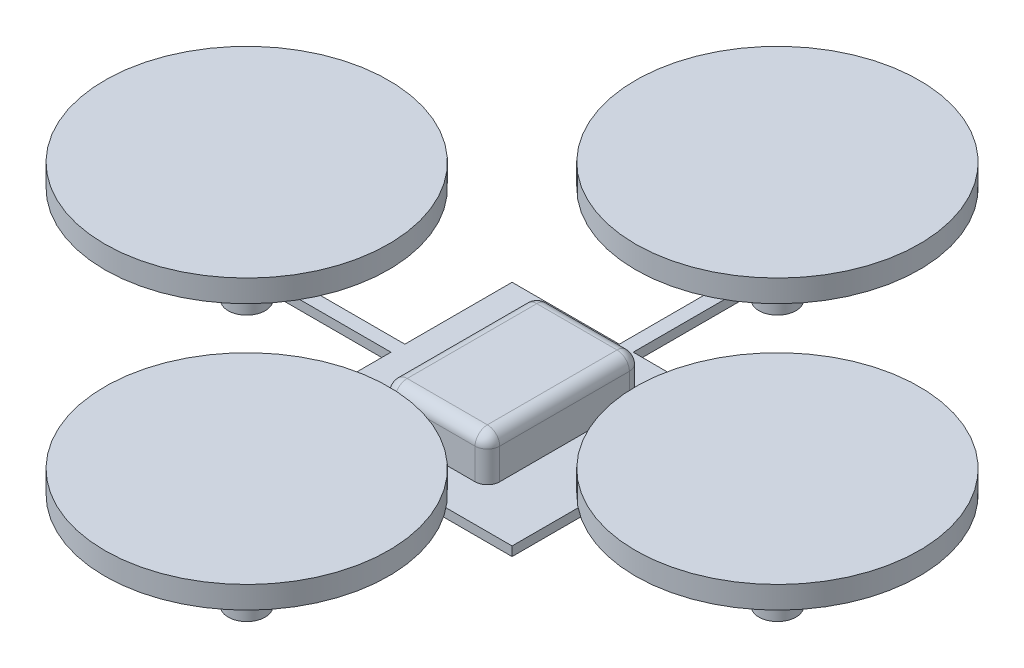
from build123d import *

# Parameters (mm, degrees)
BOSS_EXTRUDE1_DEPTH        = 1.5
BOSS_EXTRUDE2_DEPTH        = 11.75
BOSS_EXTRUDE2_DEPTH_BACK   = 4
SKETCH2_R                  = 3
BOSS_EXTRUDE2_2_DEPTH      = 11.75
BOSS_EXTRUDE2_2_DEPTH_BACK = 4
BOSS_EXTRUDE2_3_DEPTH      = 11.75
BOSS_EXTRUDE2_3_DEPTH_BACK = 4
BOSS_EXTRUDE2_4_DEPTH      = 11.75
BOSS_EXTRUDE2_4_DEPTH_BACK = 4
SKETCH6_W                  = 17
SKETCH6_H                  = 25
BOSS_EXTRUDE3_DEPTH        = 7
FILLET1_R                  = 2
SKETCH9_R                  = 23
BOSS_EXTRUDE4_DEPTH        = 3.6


with BuildPart() as part:
    # Sketch1 → Boss-Extrude1 (new body)
    with BuildSketch(Plane(origin=(0, 0, 0), x_dir=(1, 0, 0), z_dir=(0, 1, 0))):
        Polygon((1.125, 18.5), (1.125, 40), (-1.125, 40), (-1.125, 18.5), (-18.5, 18.5), (-18.5, 1.125), (-40, 1.125), (-40, -1.125), (-18.5, -1.125), (-18.5, -18.5), (-1.125, -18.5), (-1.125, -40), (1.125, -40), (1.125, -18.5), (18.5, -18.5), (18.5, -1.125), (40, -1.125), (40, 1.125), (18.5, 1.125), (18.5, 18.5), align=None)
    extrude(amount=BOSS_EXTRUDE1_DEPTH)

    # Sketch6 → Boss-Extrude3 (add)
    with BuildSketch(Plane(origin=(0, 1.5, 0), x_dir=(1, 0, 0), z_dir=(0, 1, 0))):
        Rectangle(SKETCH6_W, SKETCH6_H)
    extrude(amount=BOSS_EXTRUDE3_DEPTH)

    # Fillet1
    fillet1_edges = [part.edges().sort_by_distance(p)[0] for p in [
        (-8.5, 5, -12.5),
        (-8.5, 5, 12.5),
        (8.5, 5, 12.5),
        (8.5, 5, -12.5),
        (-8.5, 8.5, 0),
        (0, 8.5, 12.5),
        (8.5, 8.5, 0),
        (0, 8.5, -12.5),
    ]]
    fillet(fillet1_edges, radius=FILLET1_R)


with BuildPart() as body_2:
    # Sketch2 → Boss-Extrude2 (new, two sides: drawn at the far end of the back side and taken through both)
    with BuildSketch(Plane(origin=(0, 0, 0), x_dir=(1, 0, 0), z_dir=(0, 1, 0)).offset(-BOSS_EXTRUDE2_DEPTH_BACK)):
        with Locations(Location((0, 43, 0), (0, 0, 270))):
            Circle(SKETCH2_R)
    extrude(amount=BOSS_EXTRUDE2_DEPTH + BOSS_EXTRUDE2_DEPTH_BACK)



with BuildPart() as body_3:
    # Sketch2 → Boss-Extrude2 2 (new, two sides: drawn at the far end of the back side and taken through both)
    with BuildSketch(Plane(origin=(0, 0, 0), x_dir=(1, 0, 0), z_dir=(0, 1, 0)).offset(-BOSS_EXTRUDE2_2_DEPTH_BACK)):
        with Locations(Location((43, 0, 0), (0, 0, 270))):
            Circle(SKETCH2_R)
    extrude(amount=BOSS_EXTRUDE2_2_DEPTH + BOSS_EXTRUDE2_2_DEPTH_BACK)


with BuildPart() as body_4:
    # Sketch2 → Boss-Extrude2 3 (new, two sides: drawn at the far end of the back side and taken through both)
    with BuildSketch(Plane(origin=(0, 0, 0), x_dir=(1, 0, 0), z_dir=(0, 1, 0)).offset(-BOSS_EXTRUDE2_3_DEPTH_BACK)):
        with Locations(Location((0, -43, 0), (0, 0, 270))):
            Circle(SKETCH2_R)
    extrude(amount=BOSS_EXTRUDE2_3_DEPTH + BOSS_EXTRUDE2_3_DEPTH_BACK)


with BuildPart() as body_5:
    # Sketch2 → Boss-Extrude2 4 (new, two sides: drawn at the far end of the back side and taken through both)
    with BuildSketch(Plane(origin=(0, 0, 0), x_dir=(1, 0, 0), z_dir=(0, 1, 0)).offset(-BOSS_EXTRUDE2_4_DEPTH_BACK)):
        with Locations(Location((-43, 0, 0), (0, 0, 270))):
            Circle(SKETCH2_R)
    extrude(amount=BOSS_EXTRUDE2_4_DEPTH + BOSS_EXTRUDE2_4_DEPTH_BACK)


with BuildPart() as body_2_1:
    add(body_2.part)

    add(body_3.part)  # Boss-Extrude4 merges body 3

    add(body_4.part)  # Boss-Extrude4 merges body 4

    add(body_5.part)  # Boss-Extrude4 merges body 5
    # Sketch9 → Boss-Extrude4 (add)
    with BuildSketch(Plane(origin=(0, 11.75, 0), x_dir=(1, 0, 0), z_dir=(0, 1, 0))):
        with Locations(Location((0, 43, 0), (0, 0, 270))):
            Circle(SKETCH9_R)
        with Locations(Location((43, 0, 0), (0, 0, 270))):
            Circle(SKETCH9_R)
        with Locations(Location((0, -43, 0), (0, 0, 270))):
            Circle(SKETCH9_R)
        with Locations(Location((-43, 0, 0), (0, 0, 270))):
            Circle(SKETCH9_R)
    extrude(amount=BOSS_EXTRUDE4_DEPTH)


solid = Compound([part.part, body_2_1.part])
